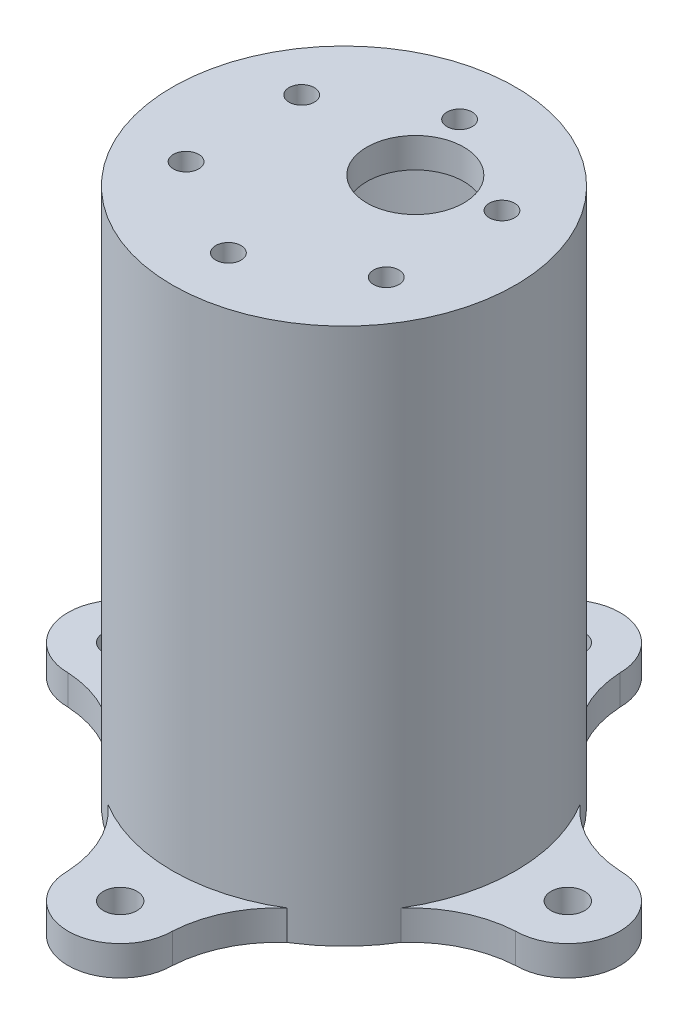
from build123d import *

# Parameters (mm, degrees)
SKETCH2_R                  = 2.25
BOSS_EXTRUDE_FLANG_DEPTH   = 4
BOSS_EXTRUDE_FLANG_2_DEPTH = 4
BOSS_EXTRUDE_FLANG_3_DEPTH = 4
BOSS_EXTRUDE_FLANG_4_DEPTH = 4
SKETCH2_3_R                = 19
BOSS_EXTRUDE_WALL_DEPTH    = 68
SKETCH5_R                  = 23
SKETCH5_R_2                = 6.5
BOSS_EXTRUDE4_DEPTH        = 4
SKETCH6_R                  = 1.7
CUT_EXTRUDE2_DEPTH         = 90.0056178
CUT_EXTRUDE4_DEPTH         = 8


with BuildPart() as part:
    # Sketch2 → Boss-Extrude_flang (new body)
    with BuildSketch(Plane(origin=(0, 0, 0), x_dir=(1, 0, 0), z_dir=(0, 1, 0))):
        with BuildLine():
            ThreePointArc((19.62141687, 12), (23, 0), (19.62141687, -12))
            ThreePointArc((19.62141687, -12), (24.31156558, -8.463920877), (30, -7))
            ThreePointArc((30, -7), (37, 0), (30, 7))
            ThreePointArc((30, 7), (24.31156558, 8.463920877), (19.62141687, 12))
        make_face()
        with Locations((30, 0)):
            Circle(SKETCH2_R, mode=Mode.SUBTRACT)
    extrude(amount=BOSS_EXTRUDE_FLANG_DEPTH)


with BuildPart() as body_2:
    # Sketch2 → Boss-Extrude_flang 2 (new body)
    with BuildSketch(Plane(origin=(0, 0, 0), x_dir=(1, 0, 0), z_dir=(0, 1, 0))):
        with BuildLine():
            ThreePointArc((-12, 19.62141687), (0, 23), (12, 19.62141687))
            ThreePointArc((12, 19.62141687), (8.463920877, 24.31156558), (7, 30))
            ThreePointArc((7, 30), (0, 37), (-7, 30))
            ThreePointArc((-7, 30), (-8.463920877, 24.31156558), (-12, 19.62141687))
        make_face()
        with Locations((0, 30)):
            Circle(SKETCH2_R, mode=Mode.SUBTRACT)
    extrude(amount=BOSS_EXTRUDE_FLANG_2_DEPTH)


with BuildPart() as body_3:
    # Sketch2 → Boss-Extrude_flang 3 (new body)
    with BuildSketch(Plane(origin=(0, 0, 0), x_dir=(1, 0, 0), z_dir=(0, 1, 0))):
        with BuildLine():
            ThreePointArc((7, -30), (8.463920877, -24.31156558), (12, -19.62141687))
            ThreePointArc((12, -19.62141687), (0, -23), (-12, -19.62141687))
            ThreePointArc((-12, -19.62141687), (-8.463920877, -24.31156558), (-7, -30))
            ThreePointArc((-7, -30), (0, -37), (7, -30))
        make_face()
        with Locations((0, -30)):
            Circle(SKETCH2_R, mode=Mode.SUBTRACT)
    extrude(amount=BOSS_EXTRUDE_FLANG_3_DEPTH)


with BuildPart() as body_4:
    # Sketch2 → Boss-Extrude_flang 4 (new body)
    with BuildSketch(Plane(origin=(0, 0, 0), x_dir=(1, 0, 0), z_dir=(0, 1, 0))):
        with BuildLine():
            ThreePointArc((-19.62141687, -12), (-23, 0), (-19.62141687, 12))
            ThreePointArc((-19.62141687, 12), (-24.31156558, 8.463920877), (-30, 7))
            ThreePointArc((-30, 7), (-37, 0), (-30, -7))
            ThreePointArc((-30, -7), (-24.31156558, -8.463920877), (-19.62141687, -12))
        make_face()
        with Locations((-30, 0)):
            Circle(SKETCH2_R, mode=Mode.SUBTRACT)
    extrude(amount=BOSS_EXTRUDE_FLANG_4_DEPTH)


with BuildPart() as body_5:
    # Sketch2<3> → Boss-Extrude_wall (new body)
    with BuildSketch(Plane(origin=(0, 0, 0), x_dir=(1, 0, 0), z_dir=(0, 1, 0))):
        with BuildLine():
            ThreePointArc((19.62141687, -12), (22.139247819, -6.233274099), (23, 0))
            ThreePointArc((23, 0), (22.139247819, 6.233274099), (19.62141687, 12))
            ThreePointArc((19.62141687, 12), (16.263455967, 16.263455967), (12, 19.62141687))
            ThreePointArc((12, 19.62141687), (0, 23), (-12, 19.62141687))
            ThreePointArc((-12, 19.62141687), (-16.263455967, 16.263455967), (-19.62141687, 12))
            ThreePointArc((-19.62141687, 12), (-23, 0), (-19.62141687, -12))
            ThreePointArc((-19.62141687, -12), (-16.263455967, -16.263455967), (-12, -19.62141687))
            ThreePointArc((-12, -19.62141687), (0, -23), (12, -19.62141687))
            ThreePointArc((12, -19.62141687), (16.263455967, -16.263455967), (19.62141687, -12))
        make_face()
        Circle(SKETCH2_3_R, mode=Mode.SUBTRACT)
    extrude(amount=BOSS_EXTRUDE_WALL_DEPTH)

    # Sketch5 → Boss-Extrude4 (add)
    with BuildSketch(Plane(origin=(0, 68, 0), x_dir=(1, 0, 0), z_dir=(0, 1, 0))):
        Circle(SKETCH5_R)
        with Locations((3.5, 6.062177826)):
            Circle(SKETCH5_R_2, mode=Mode.SUBTRACT)
    extrude(amount=BOSS_EXTRUDE4_DEPTH)

    # Sketch6 → Cut-Extrude2 (cut, through all)
    with BuildSketch(Plane(origin=(0, 72, 0), x_dir=(1, 0, 0), z_dir=(0, 1, 0))):
        with Locations((0, 15.5)):
            Circle(SKETCH6_R)
        with Locations((13.423393759, 7.75)):
            Circle(SKETCH6_R)
        with Locations((13.423393759, -7.75)):
            Circle(SKETCH6_R)
        with Locations((0, -15.5)):
            Circle(SKETCH6_R)
        with Locations((-13.423393759, -7.75)):
            Circle(SKETCH6_R)
        with Locations((-13.423393759, 7.75)):
            Circle(SKETCH6_R)
    extrude(amount=-CUT_EXTRUDE2_DEPTH, mode=Mode.SUBTRACT)

    # Sketch8 → Cut-Extrude4 (cut)
    with BuildSketch(Plane(origin=(-3.459717013, 0, -22.738301568), x_dir=(-0.988621807299977, 0, 0.15042247880861212), z_dir=(-0.15042247880861212, 0, -0.988621807299977))):
        with BuildLine():
            Line((5.996820741, 9.65), (-9.003179259, 9.65))
            ThreePointArc((-9.003179259, 9.65), (-10.503179259, 11.15), (-9.003179259, 12.65))
            Line((-9.003179259, 12.65), (5.996820741, 12.65))
            ThreePointArc((5.996820741, 12.65), (7.496820741, 11.15), (5.996820741, 9.65))
        make_face()
    extrude(amount=-CUT_EXTRUDE4_DEPTH, mode=Mode.SUBTRACT)


solid = Compound([part.part, body_2.part, body_3.part, body_4.part, body_5.part])
